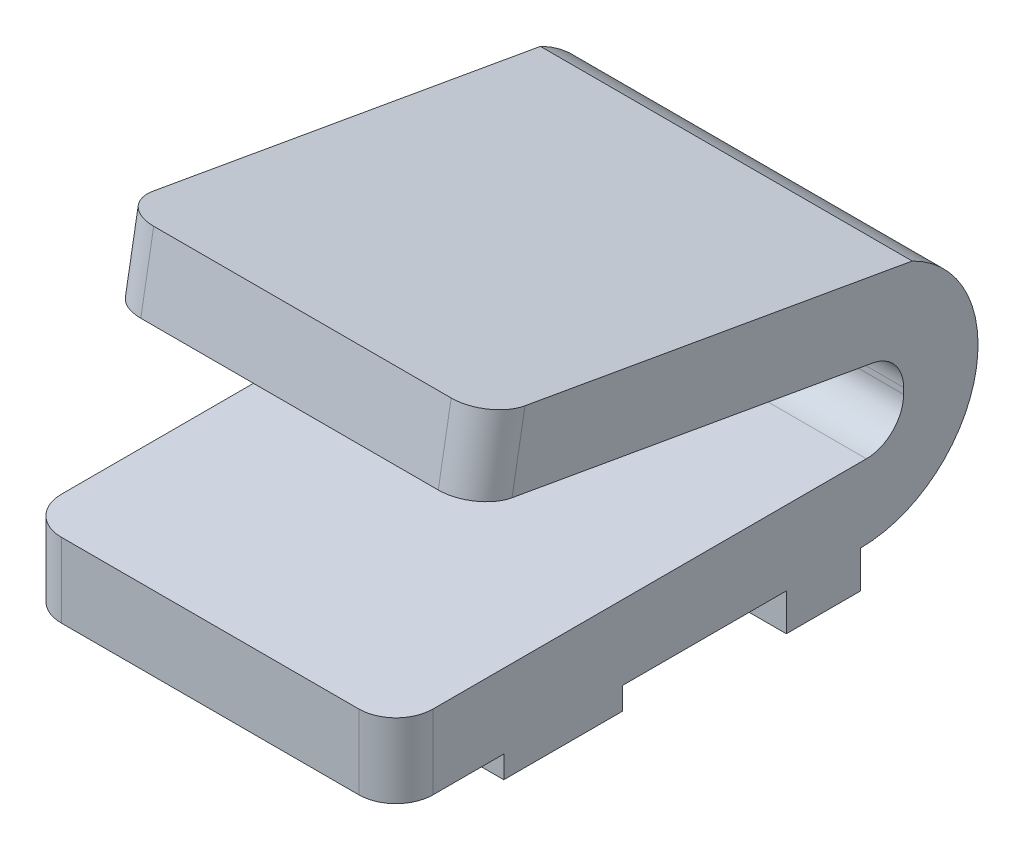
from build123d import *

# Parameters (mm, degrees)
BOSS_EXTRUDE1_DEPTH = 5
SKETCH2_W           = 1.6
SKETCH2_H           = 1.6
CUT_EXTRUDE1_DEPTH  = 0.3
FILLET1_R           = 0.5


with BuildPart() as part:
    # Sketch1 → Boss-Extrude1 (new body)
    with BuildSketch(Plane(origin=(0, 0, 0), x_dir=(0, 0, -1), z_dir=(1, 0, 0))):
        with BuildLine():
            Line((-5.181029882, 3.015192247), (-4, 2.806944814))
            Line((-4, 2.806944814), (0.163235541, 2.072854061))
            ThreePointArc((0.163235541, 2.072854061), (0.459433673, 1.901843989), (0.576411452, 1.580450184))
            Line((0.576411452, 1.580450184), (0.576411452, 1.5))
            ThreePointArc((0.576411452, 1.5), (0.429964842, 1.146446609), (0.076411452, 1))
            Line((0.076411452, 1), (-6.25, 1))
            Line((-6.25, 1), (-6.25, 0))
            Line((-6.25, 0), (-4.8, 0))
            Line((-4.8, 0), (-4.8, -0.3))
            Line((-4.8, -0.3), (-3.2, -0.3))
            Line((-3.2, -0.3), (-3.2, 0))
            Line((-3.2, 0), (-1, 0))
            Line((-1, 0), (-1, -0.5))
            Line((-1, -0.5), (0, -0.5))
            Line((0, -0.5), (0, 0))
            ThreePointArc((0, 0), (1.536997065, 1.222015685), (0.692851848, 2.994895028))
            Line((0.692851848, 2.994895028), (-5.007381704, 4))
            Line((-5.007381704, 4), (-5.181029882, 3.015192247))
        make_face()
    extrude(amount=BOSS_EXTRUDE1_DEPTH)

    # Sketch2 → Cut-Extrude1 (cut)
    with BuildSketch(Plane.XZ.offset(0.3)):
        with Locations((2.5, 4)):
            Rectangle(SKETCH2_W, SKETCH2_H)
    extrude(amount=-CUT_EXTRUDE1_DEPTH, mode=Mode.SUBTRACT)

    # Fillet1
    fillet1_edges = [part.edges().sort_by_distance(p)[0] for p in [
        (0, 0.5, 6.25),
        (0, 3.507596123, 5.094205793),
        (5, 3.507596123, 5.094205793),
        (5, 0.5, 6.25),
    ]]
    fillet(fillet1_edges, radius=FILLET1_R)


solid = part.part
